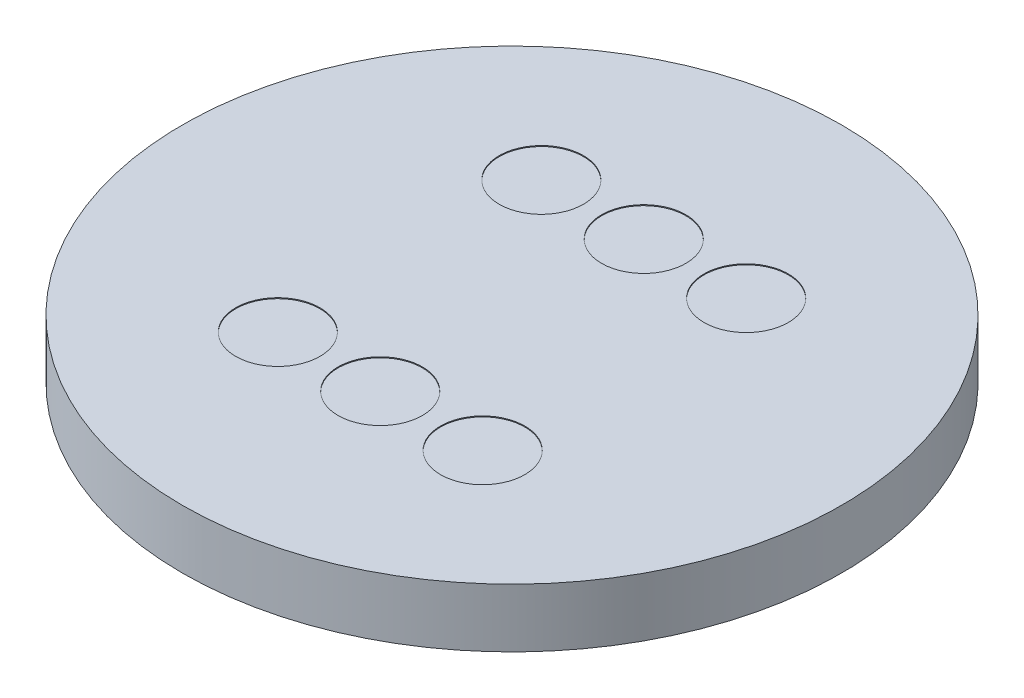
from build123d import *

# Parameters (mm, degrees)
SKETCH2_R           = 9.271
BOSS_EXTRUDE1_DEPTH = 1.651
SKETCH2_3_R         = 7.874
SKETCH2_3_R_2       = 5.1435
SKETCH2_3_R_3       = 4.826
SKETCH2_3_R_4       = 2.159
SKETCH2_3_R_5       = 1.905
CUT_EXTRUDE1_DEPTH  = 0.0254
SKETCH3_R           = 1.186010715
CUT_EXTRUDE2_DEPTH  = 0.0254


with BuildPart() as part:
    # Sketch2 → Boss-Extrude1 (new body)
    with BuildSketch(Plane(origin=(0, 0, 0), x_dir=(1, 0, 0), z_dir=(0, 1, 0))):
        Circle(SKETCH2_R)
    extrude(amount=BOSS_EXTRUDE1_DEPTH)

    # Sketch2<3> → Cut-Extrude1 (cut)
    # profile 1 of 3: a face of its own
    with BuildSketch(Plane(origin=(0, 0, 0), x_dir=(1, 0, 0), z_dir=(0, 1, 0))):
        Circle(SKETCH2_3_R)
        Circle(SKETCH2_3_R_2, mode=Mode.SUBTRACT)
    # profile 2 of 3: a face of its own
    with BuildSketch(Plane(origin=(0, 0, 0), x_dir=(1, 0, 0), z_dir=(0, 1, 0))):
        Circle(SKETCH2_3_R_3)
        Circle(SKETCH2_3_R_4, mode=Mode.SUBTRACT)
    # profile 3 of 3: a face of its own
    with BuildSketch(Plane(origin=(0, 0, 0), x_dir=(1, 0, 0), z_dir=(0, 1, 0))):
        Circle(SKETCH2_3_R_5)
    extrude(amount=CUT_EXTRUDE1_DEPTH, mode=Mode.SUBTRACT)

    # Sketch3 → Cut-Extrude2 (cut)
    with BuildSketch(Plane(origin=(0, 1.651, 0), x_dir=(1, 0, 0), z_dir=(0, 1, 0))):
        with Locations((-2.88114027, 3.706360639)):
            Circle(SKETCH3_R)
        with Locations((0, 3.706360639)):
            Circle(SKETCH3_R)
        with Locations((2.88114027, 3.706360639)):
            Circle(SKETCH3_R)
        with Locations((0, -3.706360639)):
            Circle(SKETCH3_R)
        with Locations((2.88114027, -3.706360639)):
            Circle(SKETCH3_R)
        with Locations((-2.88114027, -3.706360639)):
            Circle(SKETCH3_R)
    extrude(amount=-CUT_EXTRUDE2_DEPTH, mode=Mode.SUBTRACT)


solid = part.part
